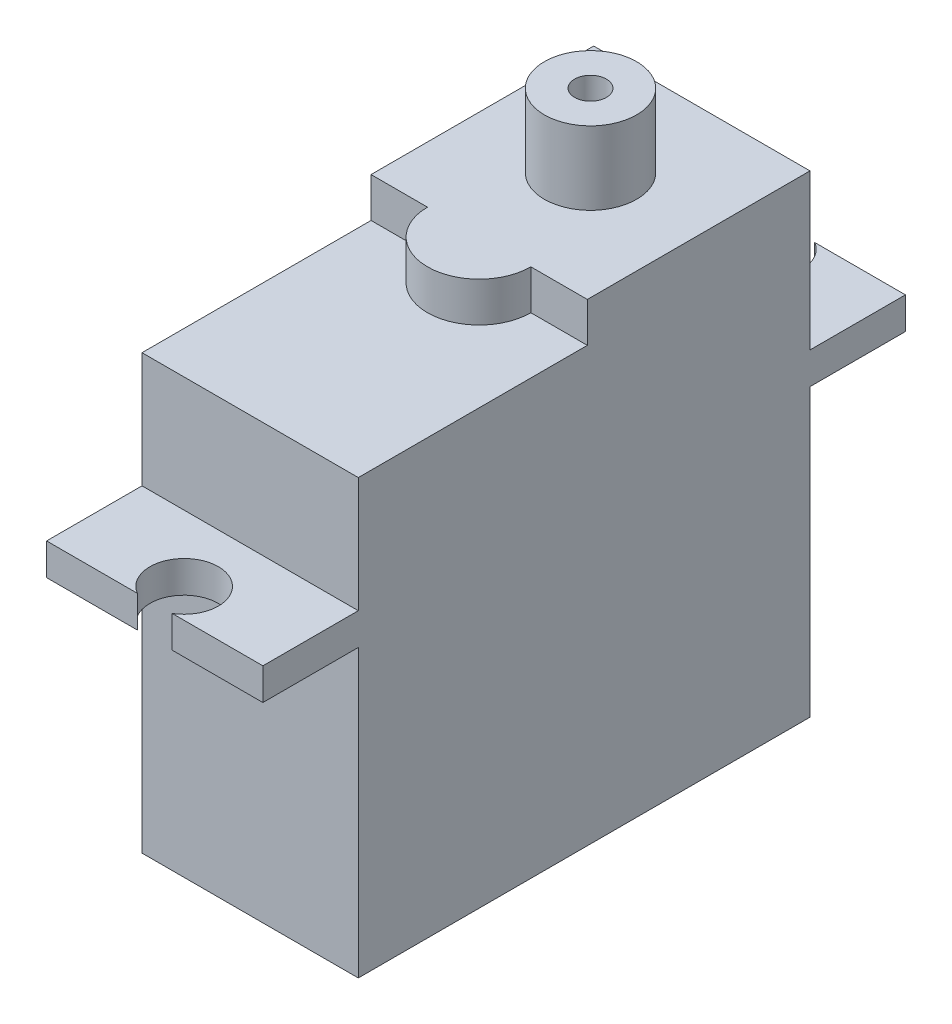
from build123d import *

# Parameters (mm, degrees)
SKETCH1_W           = 13.6
SKETCH1_H           = 28.4
BOSS_EXTRUDE1_DEPTH = 27.25
BOSS_EXTRUDE2_DEPTH = 2.5
SKETCH3_R           = 2.9
SKETCH3_R_2         = 1
BOSS_EXTRUDE3_DEPTH = 4.6
SKETCH5_W           = 13.6
SKETCH5_H           = 40.4
BOSS_EXTRUDE5_DEPTH = 2
SKETCH8_R           = 2.15
CUT_EXTRUDE1_DEPTH  = 2
SKETCH7_R           = 2.15
CUT_EXTRUDE2_DEPTH  = 2


with BuildPart() as part:
    # Sketch1 → Boss-Extrude1 (new body)
    with BuildSketch(Plane(origin=(0, 0, 0), x_dir=(1, 0, 0), z_dir=(0, 1, 0))):
        Rectangle(SKETCH1_W, SKETCH1_H)
    extrude(amount=BOSS_EXTRUDE1_DEPTH)

    # Sketch2 → Boss-Extrude2 (add)
    with BuildSketch(Plane(origin=(0, 27.25, 0), x_dir=(1, 0, 0), z_dir=(0, 1, 0))):
        with BuildLine():
            ThreePointArc((-3.25, 0.2), (0, -3.05), (3.25, 0.2))
            Line((3.25, 0.2), (-3.25, 0.2))
        make_face()
        with BuildLine():
            Line((-3.25, 0.2), (3.25, 0.2))
            ThreePointArc((3.25, 0.2), (0, 3.45), (-3.25, 0.2))
        make_face()
        with BuildLine():
            Line((6.8, 0.2), (6.8, 14.2))
            Line((6.8, 14.2), (-6.8, 14.2))
            Line((-6.8, 14.2), (-6.8, 0.2))
            Line((-6.8, 0.2), (-3.25, 0.2))
            ThreePointArc((-3.25, 0.2), (0, 3.45), (3.25, 0.2))
            Line((3.25, 0.2), (6.8, 0.2))
        make_face()
    extrude(amount=BOSS_EXTRUDE2_DEPTH)

    # Sketch3 → Boss-Extrude3 (add)
    with BuildSketch(Plane(origin=(0, 29.75, 0), x_dir=(1, 0, 0), z_dir=(0, 1, 0))):
        with Locations(Location((0, 7.2, 0), (0, 0, 270))):
            Circle(SKETCH3_R)
        with Locations(Location((0, 7.2, 0), (0, 0, 270))):
            Circle(SKETCH3_R_2, mode=Mode.SUBTRACT)
    extrude(amount=BOSS_EXTRUDE3_DEPTH)

    # Sketch5 → Boss-Extrude5 (add)
    with BuildSketch(Plane(origin=(0, 20, 0), x_dir=(-1, 0, 0), z_dir=(0, -1, 0))):
        Rectangle(SKETCH5_W, SKETCH5_H)
    extrude(amount=BOSS_EXTRUDE5_DEPTH)

    # Sketch8 → Cut-Extrude1 (cut)
    with BuildSketch(Plane(origin=(0, 20, 0), x_dir=(1, 0, 0), z_dir=(0, 1, 0))):
        with Locations((0, -18.35)):
            Circle(SKETCH8_R)
    extrude(amount=-CUT_EXTRUDE1_DEPTH, mode=Mode.SUBTRACT)

    # Sketch7 → Cut-Extrude2 (cut)
    with BuildSketch(Plane(origin=(0, 20, 0), x_dir=(1, 0, 0), z_dir=(0, 1, 0))):
        with Locations((0, 18.35)):
            Circle(SKETCH7_R)
    extrude(amount=-CUT_EXTRUDE2_DEPTH, mode=Mode.SUBTRACT)


solid = part.part
